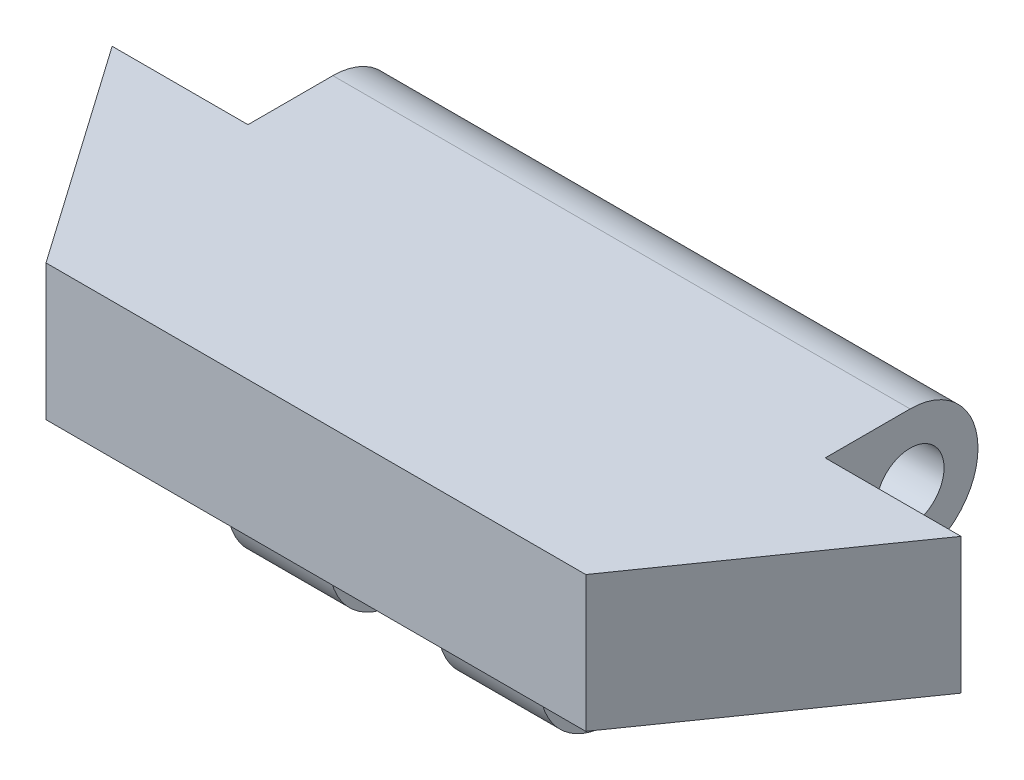
from build123d import *

# Parameters (mm, degrees)
BOSS_EXTRUDE1_DEPTH      = 4
BOSS_EXTRUDE2_START      = 4
SKETCH2_R                = 1
BOSS_EXTRUDE2_DEPTH      = 17
BOSS_EXTRUDE3_DEPTH      = 4.6
BOSS_EXTRUDE3_DEPTH_BACK = 4.6
BOSS_EXTRUDE3_START      = 12.5
SKETCH3_R                = 1
CUT_EXTRUDE1_REACH       = 29.604
SKETCH4_W                = 3.2
SKETCH4_H                = 3.5
CUT_EXTRUDE2_DEPTH       = 3.2


with BuildPart() as part:
    # Sketch1 → Boss-Extrude1 (new body)
    with BuildSketch(Plane(origin=(0, 0, 0), x_dir=(1, 0, 0), z_dir=(0, 1, 0))):
        Polygon((0, 0), (4.551348998, -6.5), (20.448651002, -6.5), (25, 0), align=None)
    extrude(amount=BOSS_EXTRUDE1_DEPTH)

    # Sketch2 → Boss-Extrude2 (add)
    with BuildSketch(Plane(origin=(0, 0, 0), x_dir=(0, 0, -1), z_dir=(1, 0, 0)).offset(BOSS_EXTRUDE2_START)):
        with BuildLine():
            Line((0, 0), (2.5, 0))
            ThreePointArc((2.5, 0), (4.5, 2), (2.5, 4))
            Line((2.5, 4), (0, 4))
            Line((0, 4), (0, 0))
        make_face()
        with Locations((2.5, 2)):
            Circle(SKETCH2_R, mode=Mode.SUBTRACT)
    extrude(amount=BOSS_EXTRUDE2_DEPTH)

    # Sketch3 → Boss-Extrude3 (add, two sides: drawn at the far end of the back side and taken through both)
    with BuildSketch(Plane(origin=(0, 0, 0), x_dir=(0, 0, -1), z_dir=(1, 0, 0)).offset(BOSS_EXTRUDE3_START - BOSS_EXTRUDE3_DEPTH_BACK)):
        with BuildLine():
            Line((-4.5, 0), (-0.5, 0))
            Line((-0.5, 0), (-0.5, -1.5))
            ThreePointArc((-0.5, -1.5), (-2.5, -3.5), (-4.5, -1.5))
            Line((-4.5, -1.5), (-4.5, 0))
        make_face()
        with Locations((-2.5, -1.5)):
            Circle(SKETCH3_R, mode=Mode.SUBTRACT)
    extrude(amount=BOSS_EXTRUDE3_DEPTH + BOSS_EXTRUDE3_DEPTH_BACK)

    # Sketch4 → Cut-Extrude1 (cut, up to next)
    with BuildSketch(Plane.XY.offset(6.5), mode=Mode.PRIVATE) as cut_extrude1_sk1:
        with Locations((12.5, -1.75)):
            Rectangle(SKETCH4_W, SKETCH4_H)
    cut_extrude1_tool1 = extrude(cut_extrude1_sk1.sketch, amount=-CUT_EXTRUDE1_REACH, mode=Mode.PRIVATE) & part.part
    add(cut_extrude1_tool1.solids().sort_by_distance((12.5, -1.75, 6.5))[0], mode=Mode.SUBTRACT)

    # Sketch5 → Cut-Extrude2 (cut)
    with BuildSketch(Plane.ZY.offset(-14.1)):
        with BuildLine():
            Line((1.983840692, 0.94613564), (-2.5, 0))
            Line((-2.5, 0), (0.5, 0))
            ThreePointArc((0.5, 0), (3.84408243, -3.607947443), (1.983840692, 0.94613564))
        make_face()
    extrude(amount=CUT_EXTRUDE2_DEPTH, mode=Mode.SUBTRACT)


solid = part.part
